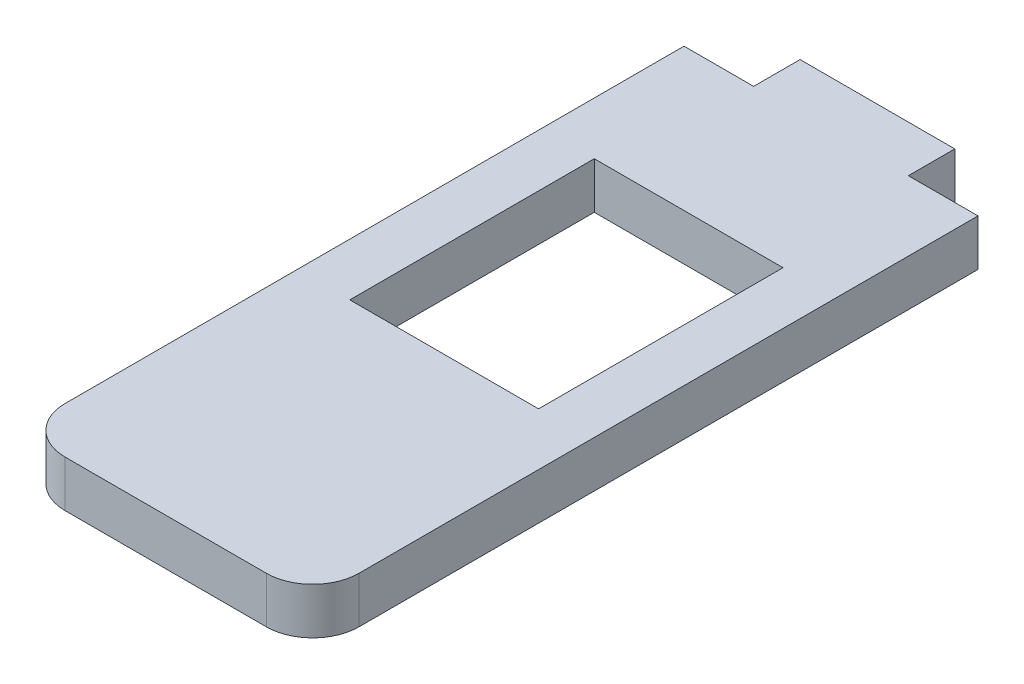
from build123d import *

# Parameters (mm, degrees)
ESQUISSE1_W        = 12.2
ESQUISSE1_H        = 15.8
BOSS_EXTRU_1_DEPTH = 3


with BuildPart() as part:
    # Esquisse1 → Boss.-Extru.1 (new body)
    with BuildSketch(Plane(origin=(0, 0, 0), x_dir=(1, 0, 0), z_dir=(0, 1, 0))):
        with BuildLine():
            Line((-9.5, 43), (-5, 43))
            Line((-5, 43), (-5, 46))
            Line((-5, 46), (5, 46))
            Line((5, 46), (5, 43))
            Line((5, 43), (9.5, 43))
            Line((9.5, 43), (9.5, 3))
            ThreePointArc((9.5, 3), (8.621320344, 0.878679656), (6.5, 0))
            Line((6.5, 0), (-6.5, 0))
            ThreePointArc((-6.5, 0), (-8.621320344, 0.878679656), (-9.5, 3))
            Line((-9.5, 3), (-9.5, 43))
        make_face()
        with Locations((0, 25.9)):
            Rectangle(ESQUISSE1_W, ESQUISSE1_H, mode=Mode.SUBTRACT)
    extrude(amount=BOSS_EXTRU_1_DEPTH)


solid = part.part
